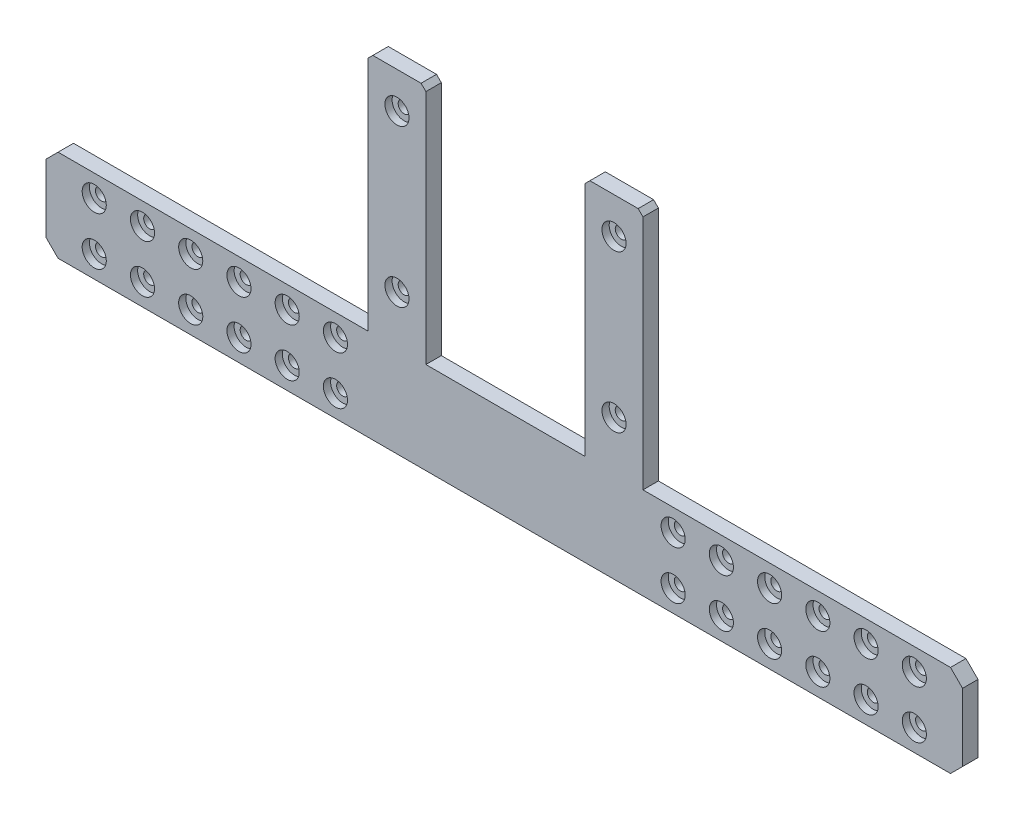
from build123d import *

# Parameters (mm, degrees)
SKETCH1_R           = 2.5
BOSS_EXTRUDE1_DEPTH = 6.4
SKETCH2_R           = 5
CUT_EXTRUDE1_DEPTH  = 3
CHAMFER1_SIZE       = 5
CHAMFER2_SIZE       = 2


with BuildPart() as part:
    # Sketch1 → Boss-Extrude1 (new body)
    with BuildSketch(Plane.XY):
        Polygon((190, -19.05), (-190, -19.05), (-190, 19.05), (-56.5, 19.05), (-56.5, 119.05), (-32.5, 119.05), (-32.5, 19.05), (33.5, 19.05), (33.5, 119.05), (57.5, 119.05), (57.5, 19.05), (190, 19.05), align=None)
        with Locations((-70, 10)):
            Circle(SKETCH1_R, mode=Mode.SUBTRACT)
        with Locations((-90, 10)):
            Circle(SKETCH1_R, mode=Mode.SUBTRACT)
        with Locations((-110, 10)):
            Circle(SKETCH1_R, mode=Mode.SUBTRACT)
        with Locations((-130, 10)):
            Circle(SKETCH1_R, mode=Mode.SUBTRACT)
        with Locations((-150, 10)):
            Circle(SKETCH1_R, mode=Mode.SUBTRACT)
        with Locations((-170, 10)):
            Circle(SKETCH1_R, mode=Mode.SUBTRACT)
        with Locations(Location((-70, -10, 0), (0, 0, 180))):
            Circle(SKETCH1_R, mode=Mode.SUBTRACT)
        with Locations(Location((-90, -10, 0), (0, 0, 180))):
            Circle(SKETCH1_R, mode=Mode.SUBTRACT)
        with Locations(Location((-110, -10, 0), (0, 0, 180))):
            Circle(SKETCH1_R, mode=Mode.SUBTRACT)
        with Locations(Location((-130, -10, 0), (0, 0, 180))):
            Circle(SKETCH1_R, mode=Mode.SUBTRACT)
        with Locations(Location((-150, -10, 0), (0, 0, 180))):
            Circle(SKETCH1_R, mode=Mode.SUBTRACT)
        with Locations(Location((-170, -10, 0), (0, 0, 180))):
            Circle(SKETCH1_R, mode=Mode.SUBTRACT)
        with Locations((170, -10)):
            Circle(SKETCH1_R, mode=Mode.SUBTRACT)
        with Locations((150, -10)):
            Circle(SKETCH1_R, mode=Mode.SUBTRACT)
        with Locations((130, -10)):
            Circle(SKETCH1_R, mode=Mode.SUBTRACT)
        with Locations((110, -10)):
            Circle(SKETCH1_R, mode=Mode.SUBTRACT)
        with Locations((90, -10)):
            Circle(SKETCH1_R, mode=Mode.SUBTRACT)
        with Locations((70, -10)):
            Circle(SKETCH1_R, mode=Mode.SUBTRACT)
        with Locations(Location((70, 10, 0), (0, 0, 180))):
            Circle(SKETCH1_R, mode=Mode.SUBTRACT)
        with Locations(Location((90, 10, 0), (0, 0, 180))):
            Circle(SKETCH1_R, mode=Mode.SUBTRACT)
        with Locations(Location((110, 10, 0), (0, 0, 180))):
            Circle(SKETCH1_R, mode=Mode.SUBTRACT)
        with Locations(Location((130, 10, 0), (0, 0, 180))):
            Circle(SKETCH1_R, mode=Mode.SUBTRACT)
        with Locations(Location((150, 10, 0), (0, 0, 180))):
            Circle(SKETCH1_R, mode=Mode.SUBTRACT)
        with Locations(Location((170, 10, 0), (0, 0, 180))):
            Circle(SKETCH1_R, mode=Mode.SUBTRACT)
        with Locations((-44.5, 39.05)):
            Circle(SKETCH1_R, mode=Mode.SUBTRACT)
        with Locations((-44.5, 104.05)):
            Circle(SKETCH1_R, mode=Mode.SUBTRACT)
        with Locations((45.5, 104.05)):
            Circle(SKETCH1_R, mode=Mode.SUBTRACT)
        with Locations((45.5, 39.05)):
            Circle(SKETCH1_R, mode=Mode.SUBTRACT)
    extrude(amount=BOSS_EXTRUDE1_DEPTH)

    # Sketch2 → Cut-Extrude1 (cut)
    with BuildSketch(Plane.XY.offset(6.4)):
        with Locations((-170, 10)):
            Circle(SKETCH2_R)
        with Locations((-150, 10)):
            Circle(SKETCH2_R)
        with Locations((-130, 10)):
            Circle(SKETCH2_R)
        with Locations((-110, 10)):
            Circle(SKETCH2_R)
        with Locations((-90, 10)):
            Circle(SKETCH2_R)
        with Locations((-70, 10)):
            Circle(SKETCH2_R)
        with Locations(Location((-70, -10, 0), (0, 0, 180))):
            Circle(SKETCH2_R)
        with Locations(Location((-90, -10, 0), (0, 0, 180))):
            Circle(SKETCH2_R)
        with Locations(Location((-110, -10, 0), (0, 0, 180))):
            Circle(SKETCH2_R)
        with Locations(Location((-130, -10, 0), (0, 0, 180))):
            Circle(SKETCH2_R)
        with Locations(Location((-150, -10, 0), (0, 0, 180))):
            Circle(SKETCH2_R)
        with Locations(Location((-170, -10, 0), (0, 0, 180))):
            Circle(SKETCH2_R)
        with Locations((170, -10)):
            Circle(SKETCH2_R)
        with Locations((150, -10)):
            Circle(SKETCH2_R)
        with Locations((130, -10)):
            Circle(SKETCH2_R)
        with Locations((110, -10)):
            Circle(SKETCH2_R)
        with Locations((90, -10)):
            Circle(SKETCH2_R)
        with Locations((70, -10)):
            Circle(SKETCH2_R)
        with Locations(Location((70, 10, 0), (0, 0, 180))):
            Circle(SKETCH2_R)
        with Locations(Location((90, 10, 0), (0, 0, 180))):
            Circle(SKETCH2_R)
        with Locations(Location((110, 10, 0), (0, 0, 180))):
            Circle(SKETCH2_R)
        with Locations(Location((130, 10, 0), (0, 0, 180))):
            Circle(SKETCH2_R)
        with Locations(Location((150, 10, 0), (0, 0, 180))):
            Circle(SKETCH2_R)
        with Locations(Location((170, 10, 0), (0, 0, 180))):
            Circle(SKETCH2_R)
        with Locations((-44.5, 104.05)):
            Circle(SKETCH2_R)
        with Locations((-44.5, 39.05)):
            Circle(SKETCH2_R)
        with Locations((45.5, 39.05)):
            Circle(SKETCH2_R)
        with Locations((45.5, 104.05)):
            Circle(SKETCH2_R)
    extrude(amount=-CUT_EXTRUDE1_DEPTH, mode=Mode.SUBTRACT)

    # Chamfer1
    chamfer1_edges = [part.edges().sort_by_distance(p)[0] for p in [
        (190, 19.05, 3.2),
        (190, -19.05, 3.2),
        (-190, -19.05, 3.2),
        (-190, 19.05, 3.2),
    ]]
    chamfer(chamfer1_edges, length=CHAMFER1_SIZE)

    # Chamfer2
    chamfer2_edges = [part.edges().sort_by_distance(p)[0] for p in [
        (-56.5, 119.05, 3.2),
        (-32.5, 119.05, 3.2),
        (33.5, 119.05, 3.2),
        (57.5, 119.05, 3.2),
    ]]
    chamfer(chamfer2_edges, length=CHAMFER2_SIZE)


solid = part.part
